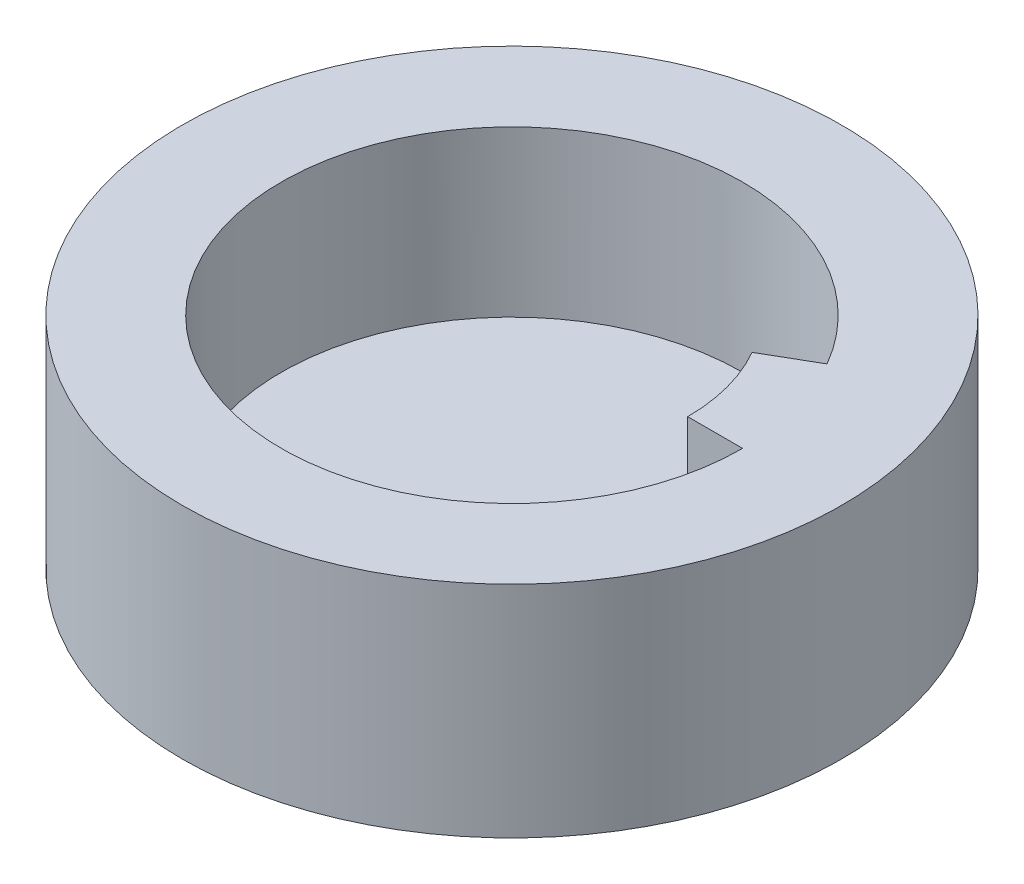
from build123d import *

# Parameters (mm, degrees)
SKETCH1_R           = 6
SKETCH1_R_2         = 4.2
BOSS_EXTRUDE1_DEPTH = 4
SKETCH1_3_R         = 6
SKETCH1_3_R_2       = 4.2
BOSS_EXTRUDE2_DEPTH = 1
BOSS_EXTRUDE3_START = 2.5
BOSS_EXTRUDE3_DEPTH = 1.5


with BuildPart() as part:
    # Sketch1 → Boss-Extrude1 (new body)
    with BuildSketch(Plane(origin=(0, 0, 0), x_dir=(1, 0, 0), z_dir=(0, 1, 0))):
        with Locations(Location((0, 0, 0), (0, 0, 270))):
            Circle(SKETCH1_R)
        with Locations(Location((0, 0, 0), (0, 0, 270))):
            Circle(SKETCH1_R_2, mode=Mode.SUBTRACT)
    extrude(amount=BOSS_EXTRUDE1_DEPTH)

    # Sketch1<3> → Boss-Extrude2 (add)
    # profile 1 of 5: a face of its own
    with BuildSketch(Plane(origin=(0, 0, 0), x_dir=(1, 0, 0), z_dir=(0, 1, 0))):
        with Locations(Location((0, 0, 0), (0, 0, 270))):
            Circle(SKETCH1_3_R)
        with Locations(Location((0, 0, 0), (0, 0, 270))):
            Circle(SKETCH1_3_R_2, mode=Mode.SUBTRACT)
    # profile 2 of 5: a face of its own
    with BuildSketch(Plane(origin=(0, 0, 0), x_dir=(1, 0, 0), z_dir=(0, 1, 0))):
        with BuildLine():
            Line((2.771281292, 1.6), (3.637306696, 2.1))
            ThreePointArc((3.637306696, 2.1), (-4.05688847, -1.087039989), (4.2, 0))
            Line((4.2, 0), (3.2, 0))
            ThreePointArc((3.2, 0), (3.090962644, 0.828220944), (2.771281292, 1.6))
        make_face()
    # profile 3 of 5: a face of its own
    with BuildSketch(Plane(origin=(0, 0, 0), x_dir=(1, 0, 0), z_dir=(0, 1, 0))):
        with BuildLine():
            ThreePointArc((4.2, 0), (4.05688847, 1.087039989), (3.637306696, 2.1))
            Line((3.637306696, 2.1), (2.771281292, 1.6))
            ThreePointArc((2.771281292, 1.6), (3.090962644, 0.828220944), (3.2, 0))
            Line((3.2, 0), (4.2, 0))
        make_face()
    # profile 4 of 5: a face of its own
    with BuildSketch(Plane(origin=(0, 0, 0), x_dir=(1, 0, 0), z_dir=(0, 1, 0))):
        with BuildLine():
            ThreePointArc((4.2, 0), (4.05688847, 1.087039989), (3.637306696, 2.1))
            Line((3.637306696, 2.1), (2.771281292, 1.6))
            ThreePointArc((2.771281292, 1.6), (3.090962644, 0.828220944), (3.2, 0))
            Line((3.2, 0), (4.2, 0))
        make_face()
    # profile 5 of 5: a face of its own
    with BuildSketch(Plane(origin=(0, 0, 0), x_dir=(1, 0, 0), z_dir=(0, 1, 0))):
        with BuildLine():
            Line((2.771281292, 1.6), (3.637306696, 2.1))
            ThreePointArc((3.637306696, 2.1), (-4.05688847, -1.087039989), (4.2, 0))
            Line((4.2, 0), (3.2, 0))
            ThreePointArc((3.2, 0), (3.090962644, 0.828220944), (2.771281292, 1.6))
        make_face()
    extrude(amount=BOSS_EXTRUDE2_DEPTH)

    # Sketch1<4> → Boss-Extrude3 (add)
    with BuildSketch(Plane(origin=(0, 0, 0), x_dir=(1, 0, 0), z_dir=(0, 1, 0)).offset(BOSS_EXTRUDE3_START)):
        with BuildLine():
            ThreePointArc((4.2, 0), (4.05688847, 1.087039989), (3.637306696, 2.1))
            Line((3.637306696, 2.1), (2.771281292, 1.6))
            ThreePointArc((2.771281292, 1.6), (3.090962644, 0.828220944), (3.2, 0))
            Line((3.2, 0), (4.2, 0))
        make_face()
    extrude(amount=BOSS_EXTRUDE3_DEPTH)


solid = part.part
